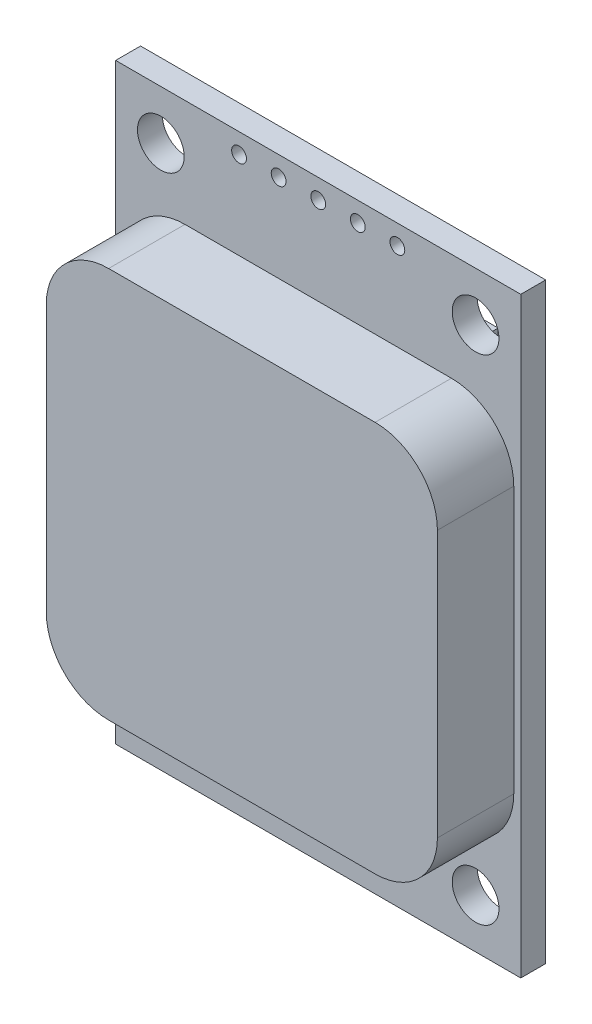
from build123d import *

# Parameters (mm, degrees)
SKETCH_1_W                 = 26
SKETCH_1_H                 = 38
EXTRUDE_1_DEPTH            = 1.6
CUT_EXTRUDE_1_REACH        = 25.077
SKETCH_2_R                 = 1.5
SKETCH_3_W                 = 25.1
SKETCH_3_H                 = 25.1
EXTRUDE_2_DEPTH            = 4.9
FILLET_1_R                 = 4
SKETCH_6_W                 = 15.1
SKETCH_6_H                 = 11.7
EXTRUDE_3_DEPTH            = 2.4
SKETCH_7_W                 = 7.9
SKETCH_7_H                 = 5.7
EXTRUDE_4_DEPTH            = 2.8
CUT_EXTRUDE_2_REACH        = 25.922
SKETCH_8_R                 = 0.475
PATTERN_LINEAR_1_COUNT     = 3
PATTERN_LINEAR_1_PITCH     = 2.54
PATTERN_LINEAR_1_COL_COUNT = 3
PATTERN_LINEAR_1_COL_PITCH = 2.54


with BuildPart() as part:
    # 草图1 → 凸台-拉伸1 (new body)
    with BuildSketch(Plane.XY):
        Rectangle(SKETCH_1_W, SKETCH_1_H)
    extrude(amount=-EXTRUDE_1_DEPTH)

    # 草图2 → 切除-拉伸1 (cut, up to next)
    with BuildSketch(Plane.XY, mode=Mode.PRIVATE) as cut_extrude_1_sk1:
        with Locations((-10.1, 15.85)):
            Circle(SKETCH_2_R)
    cut_extrude_1_tool1 = extrude(cut_extrude_1_sk1.sketch, amount=-CUT_EXTRUDE_1_REACH, mode=Mode.PRIVATE) & part.part
    # 草图2 → 切除-拉伸1 (cut, up to next)
    with BuildSketch(Plane.XY, mode=Mode.PRIVATE) as cut_extrude_1_sk2:
        with Locations((10.1, 15.85)):
            Circle(SKETCH_2_R)
    cut_extrude_1_tool2 = extrude(cut_extrude_1_sk2.sketch, amount=-CUT_EXTRUDE_1_REACH, mode=Mode.PRIVATE) & part.part
    # 草图2 → 切除-拉伸1 (cut, up to next)
    with BuildSketch(Plane.XY, mode=Mode.PRIVATE) as cut_extrude_1_sk3:
        with Locations((10.1, -15.85)):
            Circle(SKETCH_2_R)
    cut_extrude_1_tool3 = extrude(cut_extrude_1_sk3.sketch, amount=-CUT_EXTRUDE_1_REACH, mode=Mode.PRIVATE) & part.part
    # 草图2 → 切除-拉伸1 (cut, up to next)
    with BuildSketch(Plane.XY, mode=Mode.PRIVATE) as cut_extrude_1_sk4:
        with Locations((-10.1, -15.85)):
            Circle(SKETCH_2_R)
    cut_extrude_1_tool4 = extrude(cut_extrude_1_sk4.sketch, amount=-CUT_EXTRUDE_1_REACH, mode=Mode.PRIVATE) & part.part
    add(cut_extrude_1_tool1.solids().sort_by_distance((-10.1, 15.85, 0))[0], mode=Mode.SUBTRACT)
    add(cut_extrude_1_tool2.solids().sort_by_distance((10.1, 15.85, 0))[0], mode=Mode.SUBTRACT)
    add(cut_extrude_1_tool3.solids().sort_by_distance((10.1, -15.85, 0))[0], mode=Mode.SUBTRACT)
    add(cut_extrude_1_tool4.solids().sort_by_distance((-10.1, -15.85, 0))[0], mode=Mode.SUBTRACT)

    # 草图3 → 凸台-拉伸2 (add)
    with BuildSketch(Plane.XY):
        with Locations((0, -0.44)):
            Rectangle(SKETCH_3_W, SKETCH_3_H)
    extrude(amount=EXTRUDE_2_DEPTH)

    # 圆角1
    fillet_1_edges = [part.edges().sort_by_distance(p)[0] for p in [
        (-12.55, 12.11, 2.45),
        (-12.55, -12.99, 2.45),
        (12.55, -12.99, 2.45),
        (12.55, 12.11, 2.45),
    ]]
    fillet(fillet_1_edges, radius=FILLET_1_R)

    # 草图6 → 凸台-拉伸3 (add)
    with BuildSketch(Plane(origin=(0, 0, -1.6), x_dir=(-1, 0, 0), z_dir=(0, 0, -1))):
        with Locations((0, 6.55)):
            Rectangle(SKETCH_6_W, SKETCH_6_H)
    extrude(amount=EXTRUDE_3_DEPTH)

    # 草图7 → 凸台-拉伸4 (add)
    with BuildSketch(Plane(origin=(0, 0, -1.6), x_dir=(-1, 0, 0), z_dir=(0, 0, -1))):
        with Locations((0, -16.15)):
            Rectangle(SKETCH_7_W, SKETCH_7_H)
    extrude(amount=EXTRUDE_4_DEPTH)

    # 草图8 → 切除-拉伸2 (cut, up to next)
    with BuildSketch(Plane(origin=(0, 0, -1.6), x_dir=(-1, 0, 0), z_dir=(0, 0, -1)), mode=Mode.PRIVATE) as cut_extrude_2_sk1:
        with Locations((0, 17.73)):
            Circle(SKETCH_8_R)
    cut_extrude_2_tool1 = extrude(cut_extrude_2_sk1.sketch, amount=-CUT_EXTRUDE_2_REACH, mode=Mode.PRIVATE) & part.part
    cut_extrude_2 = cut_extrude_2_tool1.solids().sort_by_distance((0, 17.73, -1.6))[0]
    add(cut_extrude_2, mode=Mode.SUBTRACT)

    # 阵列(线性)1: 切除-拉伸2 ×3
    with Locations(*[(-i * PATTERN_LINEAR_1_PITCH, 0, 0) for i in range(1, PATTERN_LINEAR_1_COUNT)]):
        add(cut_extrude_2, mode=Mode.SUBTRACT)

    # 阵列(线性)1 col: 切除-拉伸2 ×3
    with Locations(*[(i * PATTERN_LINEAR_1_COL_PITCH, 0, 0) for i in range(1, PATTERN_LINEAR_1_COL_COUNT)]):
        add(cut_extrude_2, mode=Mode.SUBTRACT)


solid = part.part
